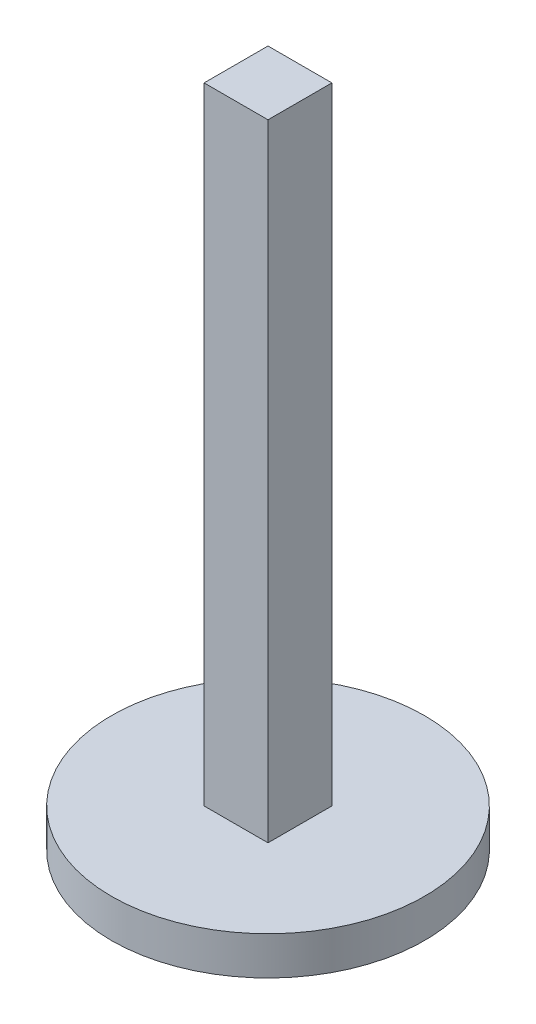
from build123d import *

# Parameters (mm, degrees)
SKETCH1_R           = 6.125
SKETCH1_W           = 2.5
SKETCH1_H           = 2.5
BOSS_EXTRUDE1_DEPTH = 1.5
SKETCH1_2_W         = 2.5
SKETCH1_2_H         = 2.5
BOSS_EXTRUDE2_DEPTH = 26


with BuildPart() as part:
    # Sketch1 → Boss-Extrude1 (new body)
    with BuildSketch(Plane(origin=(0, 0, 0), x_dir=(1, 0, 0), z_dir=(0, 1, 0))):
        Circle(SKETCH1_R)
        Rectangle(SKETCH1_W, SKETCH1_H, mode=Mode.SUBTRACT)
    extrude(amount=BOSS_EXTRUDE1_DEPTH)

    # Sketch1<2> → Boss-Extrude2 (add)
    with BuildSketch(Plane(origin=(0, 0, 0), x_dir=(1, 0, 0), z_dir=(0, 1, 0))):
        Rectangle(SKETCH1_2_W, SKETCH1_2_H)
    extrude(amount=BOSS_EXTRUDE2_DEPTH)


solid = part.part
